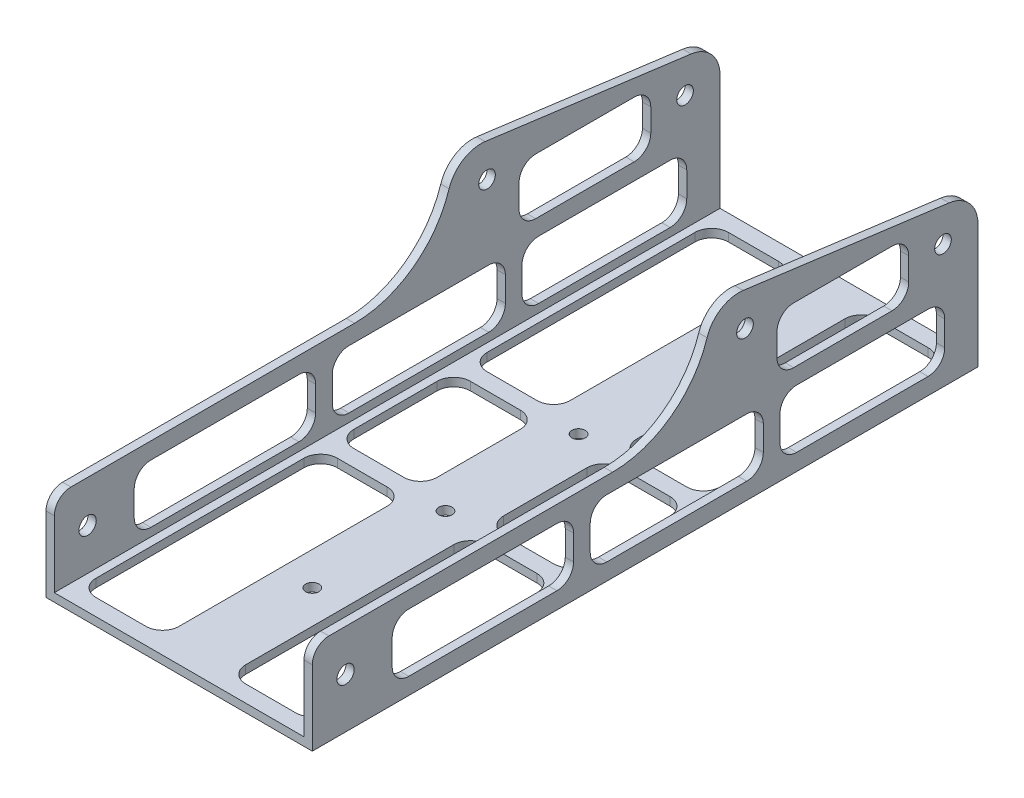
from build123d import *

# Parameters (mm, degrees)
BOSS_EXTRUDE1_DEPTH = 254
SKETCH2_R           = 3.302
SKETCH2_R_2         = 3.175
CUT_EXTRUDE1_DEPTH  = 203.2
SKETCH3_R           = 2.54
CUT_EXTRUDE2_DEPTH  = 9.525
CUT_EXTRUDE3_DEPTH  = 284.145211199
SKETCH5_R           = 3.175
CUT_EXTRUDE4_DEPTH  = 284.145211199
CUT_EXTRUDE6_DEPTH  = 284.145211199
FILLET1_R           = 12.7
FILLET2_R           = 6.35
CUT_EXTRUDE7_DEPTH  = 283.420503915
CUT_EXTRUDE8_DEPTH  = 116.332


with BuildPart() as part:
    # Sketch1 → Boss-Extrude1 (new body)
    with BuildSketch(Plane.XY):
        Polygon((0, 0), (0, 73.025), (3.175, 73.025), (3.175, 3.175), (98.425, 3.175), (98.425, 73.025), (101.6, 73.025), (101.6, 0), align=None)
    extrude(amount=BOSS_EXTRUDE1_DEPTH)

    # Sketch2 → Cut-Extrude1 (cut)
    with BuildSketch(Plane(origin=(101.6, 0, 0), x_dir=(0, 0, -1), z_dir=(1, 0, 0))):
        with Locations((-241.3, 19.05)):
            Circle(SKETCH2_R)
        with Locations((-88.9, 57.15)):
            Circle(SKETCH2_R_2)
    extrude(amount=-CUT_EXTRUDE1_DEPTH, mode=Mode.SUBTRACT)

    # Sketch3 → Cut-Extrude2 (cut)
    with BuildSketch(Plane(origin=(0, 3.175, 0), x_dir=(1, 0, 0), z_dir=(0, 1, 0))):
        with Locations(Location((50.8, -50.8, 0), (0, 0, 270))):
            Circle(SKETCH3_R)
        with Locations(Location((50.8, -101.6, 0), (0, 0, 270))):
            Circle(SKETCH3_R)
        with Locations(Location((50.8, -152.4, 0), (0, 0, 270))):
            Circle(SKETCH3_R)
        with Locations(Location((50.8, -203.2, 0), (0, 0, 270))):
            Circle(SKETCH3_R)
    extrude(amount=-CUT_EXTRUDE2_DEPTH, mode=Mode.SUBTRACT)

    # Sketch4 → Cut-Extrude3 (cut, through all)
    with BuildSketch(Plane(origin=(101.6, 0, 0), x_dir=(0, 0, -1), z_dir=(1, 0, 0))):
        with BuildLine():
            Line((-254, 73.025), (-101.6, 73.025))
            Line((-101.6, 73.025), (-101.6, 72.771))
            ThreePointArc((-101.6, 72.771), (-112.684836759, 46.009836759), (-139.446, 34.925))
            Line((-139.446, 34.925), (-254, 34.925))
            Line((-254, 34.925), (-254, 73.025))
        make_face()
    extrude(amount=-CUT_EXTRUDE3_DEPTH, mode=Mode.SUBTRACT)

    # Sketch5 → Cut-Extrude4 (cut, through all)
    with BuildSketch(Plane.ZY):
        with Locations((13.351901563, 47.203904153)):
            Circle(SKETCH5_R)
    extrude(amount=-CUT_EXTRUDE4_DEPTH, mode=Mode.SUBTRACT)

    # Sketch6 → Cut-Extrude6 (cut, through all)
    with BuildSketch(Plane.ZY):
        with BuildLine():
            ThreePointArc((101.6, 72.771), (101.604272359, 72.202347935), (101.617088473, 71.633824259))
            Line((101.617088473, 71.633824259), (117.259257027, 73.693154817))
            Line((117.259257027, 73.693154817), (117.259257027, 83.648914128))
            Line((117.259257027, 83.648914128), (-7.022067506, 78.935998732))
            Line((-7.022067506, 78.935998732), (-12.481674063, 56.612437199))
            Line((-12.481674063, 56.612437199), (0, 58.255680764))
            Line((0, 58.255680764), (0, 73.025))
            Line((0, 73.025), (101.6, 73.025))
            Line((101.6, 73.025), (101.6, 72.771))
        make_face()
        with BuildLine():
            Line((0, 58.255680764), (11.694218922, 59.795253892))
            Line((11.694218922, 59.795253892), (101.617088473, 71.633824259))
            ThreePointArc((101.617088473, 71.633824259), (101.604272359, 72.202347935), (101.6, 72.771))
            Line((101.6, 72.771), (101.6, 73.025))
            Line((101.6, 73.025), (0, 73.025))
            Line((0, 73.025), (0, 58.255680764))
        make_face()
    extrude(amount=-CUT_EXTRUDE6_DEPTH, mode=Mode.SUBTRACT)

    # Fillet1
    fillet1_edges = [part.edges().sort_by_distance(p)[0] for p in [
        (100.0125, 71.633824259, 101.617088473),
        (1.5875, 71.633824259, 101.617088473),
        (1.5875, 58.255680764, 0),
        (100.0125, 58.255680764, 0),
    ]]
    fillet(fillet1_edges, radius=FILLET1_R)

    # Fillet2
    fillet2_edges = [part.edges().sort_by_distance(p)[0] for p in [
        (100.0125, 34.925, 254),
        (1.5875, 34.925, 254),
    ]]
    fillet(fillet2_edges, radius=FILLET2_R)

    # Sketch7 → Cut-Extrude7 (cut, through all)
    with BuildSketch(Plane.ZY):
        with BuildLine():
            Line((26.426168463, 49.938693078), (26.426168463, 41.275))
            ThreePointArc((26.426168463, 41.275), (28.286040403, 36.784871939), (32.776168463, 34.925))
            Line((32.776168463, 34.925), (70.34221886, 34.925))
            ThreePointArc((70.34221886, 34.925), (74.832346921, 36.784871939), (76.69221886, 41.275))
            Line((76.69221886, 41.275), (76.69221886, 49.938693078))
            ThreePointArc((76.69221886, 49.938693078), (74.832346921, 54.428821139), (70.34221886, 56.288693078))
            Line((70.34221886, 56.288693078), (32.776168463, 56.288693078))
            ThreePointArc((32.776168463, 56.288693078), (28.286040403, 54.428821139), (26.426168463, 49.938693078))
        make_face()
        with BuildLine():
            Line((69.215, 28.575), (19.05, 28.575))
            ThreePointArc((19.05, 28.575), (14.559871939, 26.715128061), (12.7, 22.225))
            Line((12.7, 22.225), (12.7, 12.7))
            ThreePointArc((12.7, 12.7), (14.559871939, 8.209871939), (19.05, 6.35))
            Line((19.05, 6.35), (69.215, 6.35))
            ThreePointArc((69.215, 6.35), (73.705128061, 8.209871939), (75.565, 12.7))
            Line((75.565, 12.7), (75.565, 22.225))
            ThreePointArc((75.565, 22.225), (73.705128061, 26.715128061), (69.215, 28.575))
        make_face()
        with BuildLine():
            Line((81.915, 22.225), (81.915, 12.7))
            ThreePointArc((81.915, 12.7), (83.774871939, 8.209871939), (88.265, 6.35))
            Line((88.265, 6.35), (141.605, 6.35))
            ThreePointArc((141.605, 6.35), (146.095128061, 8.209871939), (147.955, 12.7))
            Line((147.955, 12.7), (147.955, 22.225))
            ThreePointArc((147.955, 22.225), (146.095128061, 26.715128061), (141.605, 28.575))
            Line((141.605, 28.575), (88.265, 28.575))
            ThreePointArc((88.265, 28.575), (83.774871939, 26.715128061), (81.915, 22.225))
        make_face()
        with BuildLine():
            Line((154.305, 22.225), (154.305, 12.7))
            ThreePointArc((154.305, 12.7), (156.164871939, 8.209871939), (160.655, 6.35))
            Line((160.655, 6.35), (217.17, 6.35))
            ThreePointArc((217.17, 6.35), (221.660128061, 8.209871939), (223.52, 12.7))
            Line((223.52, 12.7), (223.52, 22.225))
            ThreePointArc((223.52, 22.225), (221.660128061, 26.715128061), (217.17, 28.575))
            Line((217.17, 28.575), (160.655, 28.575))
            ThreePointArc((160.655, 28.575), (156.164871939, 26.715128061), (154.305, 22.225))
        make_face()
    extrude(amount=-CUT_EXTRUDE7_DEPTH, mode=Mode.SUBTRACT)

    # Sketch8 → Cut-Extrude8 (cut)
    with BuildSketch(Plane.XZ):
        with BuildLine():
            Line((31.75, 247.65), (12.7, 247.65))
            ThreePointArc((12.7, 247.65), (8.209871939, 245.790128061), (6.35, 241.3))
            Line((6.35, 241.3), (6.35, 212.725))
            ThreePointArc((6.35, 212.725), (8.209871939, 208.234871939), (12.7, 206.375))
            Line((12.7, 206.375), (31.75, 206.375))
            ThreePointArc((31.75, 206.375), (36.240128061, 208.234871939), (38.1, 212.725))
            Line((38.1, 212.725), (38.1, 241.3))
            ThreePointArc((38.1, 241.3), (36.240128061, 245.790128061), (31.75, 247.65))
        make_face()
        with BuildLine():
            ThreePointArc((88.9, 206.375), (93.390128061, 208.234871939), (95.25, 212.725))
            Line((95.25, 212.725), (95.25, 241.3))
            ThreePointArc((95.25, 241.3), (93.390128061, 245.790128061), (88.9, 247.65))
            Line((88.9, 247.65), (69.85, 247.65))
            ThreePointArc((69.85, 247.65), (65.359871939, 245.790128061), (63.5, 241.3))
            Line((63.5, 241.3), (63.5, 212.725))
            ThreePointArc((63.5, 212.725), (65.359871939, 208.234871939), (69.85, 206.375))
            Line((69.85, 206.375), (88.9, 206.375))
        make_face()
        with BuildLine():
            Line((31.75, 200.025), (12.7, 200.025))
            ThreePointArc((12.7, 200.025), (8.209871939, 198.165128061), (6.35, 193.675))
            Line((6.35, 193.675), (6.35, 161.925))
            ThreePointArc((6.35, 161.925), (8.209871939, 157.434871939), (12.7, 155.575))
            Line((12.7, 155.575), (31.75, 155.575))
            ThreePointArc((31.75, 155.575), (36.240128061, 157.434871939), (38.1, 161.925))
            Line((38.1, 161.925), (38.1, 193.675))
            ThreePointArc((38.1, 193.675), (36.240128061, 198.165128061), (31.75, 200.025))
        make_face()
        with BuildLine():
            ThreePointArc((88.9, 155.575), (93.390128061, 157.434871939), (95.25, 161.925))
            Line((95.25, 161.925), (95.25, 193.675))
            ThreePointArc((95.25, 193.675), (93.390128061, 198.165128061), (88.9, 200.025))
            Line((88.9, 200.025), (69.85, 200.025))
            ThreePointArc((69.85, 200.025), (65.359871939, 198.165128061), (63.5, 193.675))
            Line((63.5, 193.675), (63.5, 161.925))
            ThreePointArc((63.5, 161.925), (65.359871939, 157.434871939), (69.85, 155.575))
            Line((69.85, 155.575), (88.9, 155.575))
        make_face()
        with BuildLine():
            Line((31.75, 149.225), (12.7, 149.225))
            ThreePointArc((12.7, 149.225), (8.209871939, 147.365128061), (6.35, 142.875))
            Line((6.35, 142.875), (6.35, 111.125))
            ThreePointArc((6.35, 111.125), (8.209871939, 106.634871939), (12.7, 104.775))
            Line((12.7, 104.775), (31.75, 104.775))
            ThreePointArc((31.75, 104.775), (36.240128061, 106.634871939), (38.1, 111.125))
            Line((38.1, 111.125), (38.1, 142.875))
            ThreePointArc((38.1, 142.875), (36.240128061, 147.365128061), (31.75, 149.225))
        make_face()
        with BuildLine():
            ThreePointArc((88.9, 104.775), (93.390128061, 106.634871939), (95.25, 111.125))
            Line((95.25, 111.125), (95.25, 142.875))
            ThreePointArc((95.25, 142.875), (93.390128061, 147.365128061), (88.9, 149.225))
            Line((88.9, 149.225), (69.85, 149.225))
            ThreePointArc((69.85, 149.225), (65.359871939, 147.365128061), (63.5, 142.875))
            Line((63.5, 142.875), (63.5, 111.125))
            ThreePointArc((63.5, 111.125), (65.359871939, 106.634871939), (69.85, 104.775))
            Line((69.85, 104.775), (88.9, 104.775))
        make_face()
        with BuildLine():
            ThreePointArc((38.1, 60.325), (36.240128061, 55.834871939), (31.75, 53.975))
            Line((31.75, 53.975), (12.7, 53.975))
            ThreePointArc((12.7, 53.975), (8.209871939, 55.834871939), (6.35, 60.325))
            Line((6.35, 60.325), (6.35, 92.075))
            ThreePointArc((6.35, 92.075), (8.209871939, 96.565128061), (12.7, 98.425))
            Line((12.7, 98.425), (31.75, 98.425))
            ThreePointArc((31.75, 98.425), (36.240128061, 96.565128061), (38.1, 92.075))
            Line((38.1, 92.075), (38.1, 60.325))
        make_face()
        with BuildLine():
            Line((63.5, 92.075), (63.5, 60.325))
            ThreePointArc((63.5, 60.325), (65.359871939, 55.834871939), (69.85, 53.975))
            Line((69.85, 53.975), (88.9, 53.975))
            ThreePointArc((88.9, 53.975), (93.390128061, 55.834871939), (95.25, 60.325))
            Line((95.25, 60.325), (95.25, 92.075))
            ThreePointArc((95.25, 92.075), (93.390128061, 96.565128061), (88.9, 98.425))
            Line((88.9, 98.425), (69.85, 98.425))
            ThreePointArc((69.85, 98.425), (65.359871939, 96.565128061), (63.5, 92.075))
        make_face()
        with BuildLine():
            Line((31.75, 47.625), (12.7, 47.625))
            ThreePointArc((12.7, 47.625), (8.209871939, 45.765128061), (6.35, 41.275))
            Line((6.35, 41.275), (6.35, 12.7))
            ThreePointArc((6.35, 12.7), (8.209871939, 8.209871939), (12.7, 6.35))
            Line((12.7, 6.35), (31.75, 6.35))
            ThreePointArc((31.75, 6.35), (36.240128061, 8.209871939), (38.1, 12.7))
            Line((38.1, 12.7), (38.1, 41.275))
            ThreePointArc((38.1, 41.275), (36.240128061, 45.765128061), (31.75, 47.625))
        make_face()
        with BuildLine():
            ThreePointArc((69.85, 47.625), (65.359871939, 45.765128061), (63.5, 41.275))
            Line((63.5, 41.275), (63.5, 12.7))
            ThreePointArc((63.5, 12.7), (65.359871939, 8.209871939), (69.85, 6.35))
            Line((69.85, 6.35), (88.9, 6.35))
            ThreePointArc((88.9, 6.35), (93.390128061, 8.209871939), (95.25, 12.7))
            Line((95.25, 12.7), (95.25, 41.275))
            ThreePointArc((95.25, 41.275), (93.390128061, 45.765128061), (88.9, 47.625))
            Line((88.9, 47.625), (69.85, 47.625))
        make_face()
        with BuildLine():
            Line((38.1, 193.675), (38.1, 212.725))
            ThreePointArc((38.1, 212.725), (36.240128061, 208.234871939), (31.75, 206.375))
            Line((31.75, 206.375), (12.7, 206.375))
            ThreePointArc((12.7, 206.375), (8.209871939, 208.234871939), (6.35, 212.725))
            Line((6.35, 212.725), (6.35, 193.675))
            ThreePointArc((6.35, 193.675), (8.209871939, 198.165128061), (12.7, 200.025))
            Line((12.7, 200.025), (31.75, 200.025))
            ThreePointArc((31.75, 200.025), (36.240128061, 198.165128061), (38.1, 193.675))
        make_face()
        with BuildLine():
            Line((38.1, 41.275), (38.1, 60.325))
            ThreePointArc((38.1, 60.325), (36.240128061, 55.834871939), (31.75, 53.975))
            Line((31.75, 53.975), (12.7, 53.975))
            ThreePointArc((12.7, 53.975), (8.209871939, 55.834871939), (6.35, 60.325))
            Line((6.35, 60.325), (6.35, 41.275))
            ThreePointArc((6.35, 41.275), (8.209871939, 45.765128061), (12.7, 47.625))
            Line((12.7, 47.625), (31.75, 47.625))
            ThreePointArc((31.75, 47.625), (36.240128061, 45.765128061), (38.1, 41.275))
        make_face()
        with BuildLine():
            ThreePointArc((88.9, 200.025), (93.390128061, 198.165128061), (95.25, 193.675))
            Line((95.25, 193.675), (95.25, 212.725))
            ThreePointArc((95.25, 212.725), (93.390128061, 208.234871939), (88.9, 206.375))
            Line((88.9, 206.375), (69.85, 206.375))
            ThreePointArc((69.85, 206.375), (65.359871939, 208.234871939), (63.5, 212.725))
            Line((63.5, 212.725), (63.5, 203.2))
            Line((63.5, 203.2), (63.5, 193.675))
            ThreePointArc((63.5, 193.675), (65.359871939, 198.165128061), (69.85, 200.025))
            Line((69.85, 200.025), (88.9, 200.025))
        make_face()
        with BuildLine():
            Line((63.5, 60.325), (63.5, 50.8))
            Line((63.5, 50.8), (63.5, 41.275))
            ThreePointArc((63.5, 41.275), (65.359871939, 45.765128061), (69.85, 47.625))
            Line((69.85, 47.625), (88.9, 47.625))
            ThreePointArc((88.9, 47.625), (93.390128061, 45.765128061), (95.25, 41.275))
            Line((95.25, 41.275), (95.25, 60.325))
            ThreePointArc((95.25, 60.325), (93.390128061, 55.834871939), (88.9, 53.975))
            Line((88.9, 53.975), (69.85, 53.975))
            ThreePointArc((69.85, 53.975), (65.359871939, 55.834871939), (63.5, 60.325))
        make_face()
    extrude(amount=-CUT_EXTRUDE8_DEPTH, mode=Mode.SUBTRACT)


solid = part.part
